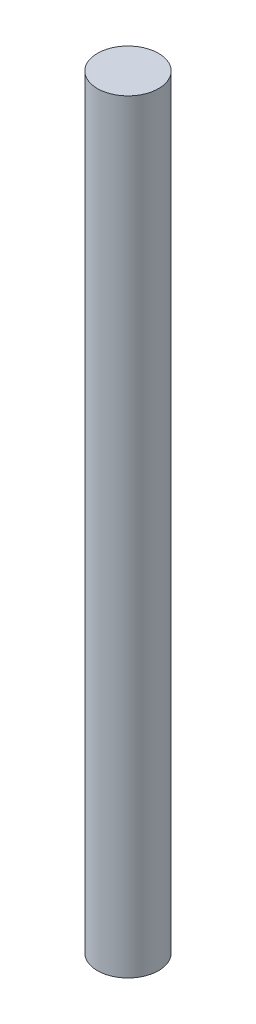
from build123d import *

# Parameters (mm, degrees)
SKETCH1_R           = 0.508
BOSS_EXTRUDE1_DEPTH = 12.7


with BuildPart() as part:
    # Sketch1 → Boss-Extrude1 (new body)
    with BuildSketch(Plane(origin=(0, 0, 0), x_dir=(1, 0, 0), z_dir=(0, 1, 0))):
        with Locations(Location((-0.027759022, 0, 0), (0, 0, 270))):
            Circle(SKETCH1_R)
    extrude(amount=BOSS_EXTRUDE1_DEPTH)


solid = part.part
